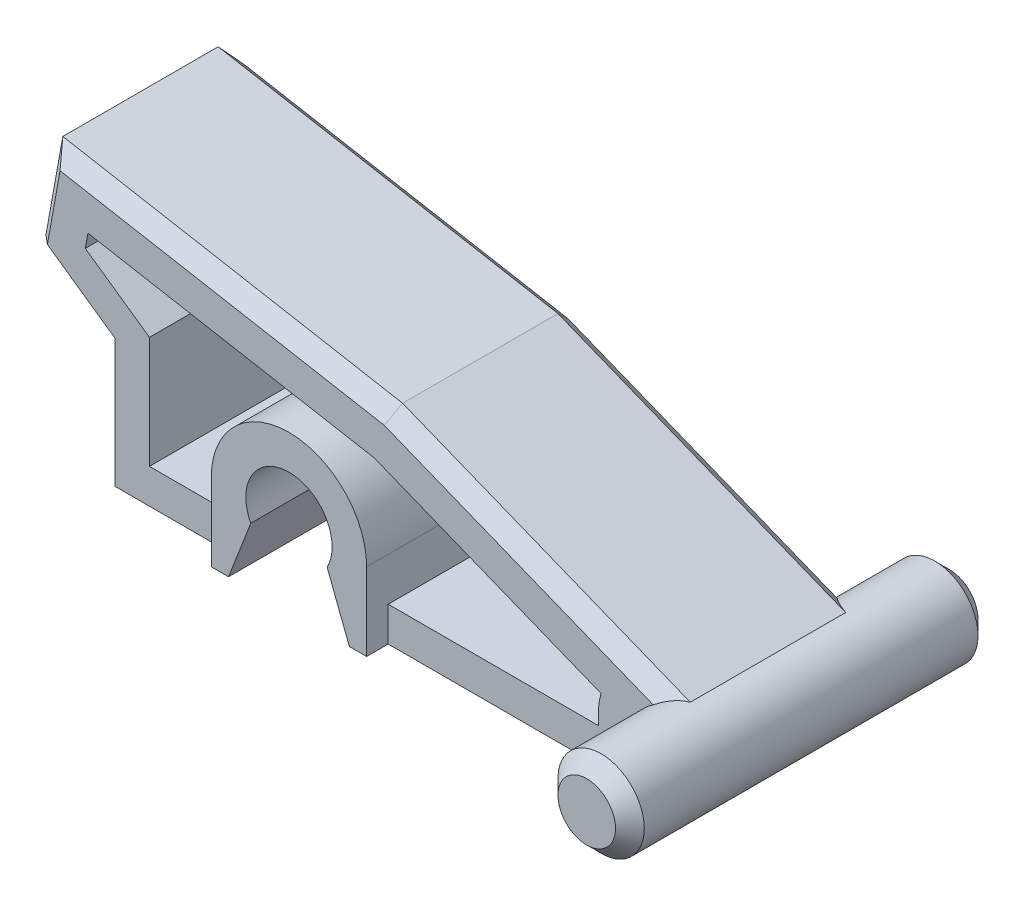
from build123d import *

# Parameters (mm, degrees)
BOSS_EXTRUDE1_DEPTH     = 3.2
BOSS_EXTRUDE2_DEPTH     = 0.75
CUT_EXTRUDE1_DEPTH      = 16.439388307
CUT_EXTRUDE1_DEPTH_BACK = 16.439388307
SKETCH4_R               = 1.5
BOSS_EXTRUDE3_DEPTH     = 6.3
CHAMFER1_SIZE           = 0.5
CHAMFER2_SIZE           = 0.5
CUT_EXTRUDE2_DEPTH      = 5.2


with BuildPart() as part:
    # Sketch1 → Boss-Extrude1 (new, symmetric)
    with BuildSketch(Plane.XY):
        Polygon((-10, -4.4), (10, -4.4), (10, -1.4), (0, 2.6), (-10, 4.4), (-10, -0.2), align=None)
        Polygon((-12.394804782, 1.478031011), (-10, -0.2), (-10, 4.4), (-11.810199888, 4.72583598), align=None)
    extrude(amount=BOSS_EXTRUDE1_DEPTH, both=True)

    # Sketch2 → Boss-Extrude2 (add, symmetric)
    with BuildSketch(Plane.XY.offset(3.2)):
        with BuildLine():
            ThreePointArc((0, -1.7), (-2.7, 1), (-5.4, -1.7))
            Line((-5.4, -1.7), (-2.7, -4.4))
            Line((-2.7, -4.4), (0, -1.7))
        make_face()
        with BuildLine():
            Line((-2.7, -4.4), (-5.4, -1.7))
            ThreePointArc((-5.4, -1.7), (-4.609188309, -3.609188309), (-2.7, -4.4))
        make_face()
        with BuildLine():
            Line((0, -1.7), (-2.7, -4.4))
            ThreePointArc((-2.7, -4.4), (-0.790811691, -3.609188309), (0, -1.7))
        make_face()
        with BuildLine():
            ThreePointArc((0, -1.7), (-0.790811691, -3.609188309), (-2.7, -4.4))
            Line((-2.7, -4.4), (0, -4.4))
            Line((0, -4.4), (0, -1.7))
        make_face()
        with BuildLine():
            ThreePointArc((-2.7, -4.4), (-4.609188309, -3.609188309), (-5.4, -1.7))
            Line((-5.4, -1.7), (-5.4, -4.4))
            Line((-5.4, -4.4), (-2.7, -4.4))
        make_face()
    boss_extrude2 = extrude(amount=BOSS_EXTRUDE2_DEPTH, both=True)

    # Mirror1: Boss-Extrude2 across plane
    add(boss_extrude2.mirror(Plane.XY))

    # Sketch3 → Cut-Extrude1 (cut, two sides: drawn at the far end of the back side and taken through both)
    with BuildSketch(Plane.XY.offset(3.95).offset(-CUT_EXTRUDE1_DEPTH_BACK)):
        with BuildLine():
            ThreePointArc((-1.2, -1.7), (-3.060572549, -0.243982336), (-4.026649916, -2.4))
            Line((-4.026649916, -2.4), (-1.373350084, -2.4))
            ThreePointArc((-1.373350084, -2.4), (-1.243982336, -2.060572549), (-1.2, -1.7))
        make_face()
        with BuildLine():
            Line((-1.373350084, -2.4), (-4.026649916, -2.4))
            ThreePointArc((-4.026649916, -2.4), (-2.7, -3.2), (-1.373350084, -2.4))
        make_face()
        with BuildLine():
            Line((-4.026649916, -2.4), (-4.8, -4.4))
            Line((-4.8, -4.4), (-0.6, -4.4))
            Line((-0.6, -4.4), (-1.373350084, -2.4))
            ThreePointArc((-1.373350084, -2.4), (-2.7, -3.2), (-4.026649916, -2.4))
        make_face()
    extrude(amount=CUT_EXTRUDE1_DEPTH + CUT_EXTRUDE1_DEPTH_BACK, mode=Mode.SUBTRACT)

    # Sketch4 → Boss-Extrude3 (add, symmetric)
    with BuildSketch(Plane.XY):
        with Locations((10, -2.9)):
            Circle(SKETCH4_R)
    extrude(amount=BOSS_EXTRUDE3_DEPTH, both=True)

    # Chamfer1
    chamfer1_edges = [part.edges().sort_by_distance(p)[0] for p in [
        (8.5, -2.9, -6.3),
        (8.5, -2.9, 6.3),
    ]]
    chamfer(chamfer1_edges, length=CHAMFER1_SIZE)

    # Chamfer2
    chamfer2_edges = [part.edges().sort_by_distance(p)[0] for p in [
        (-5.905099944, 3.66291799, 3.2),
        (-11.197402391, 0.639015505, -3.2),
        (-12.102502335, 3.101933495, -3.2),
        (-5.905099944, 3.66291799, -3.2),
        (5, 0.6, -3.2),
        (-12.102502335, 3.101933495, 3.2),
        (-11.197402391, 0.639015505, 3.2),
        (-10, -2.3, 3.2),
        (5, 0.6, 3.2),
        (-10, -2.3, -3.2),
    ]]
    chamfer(chamfer2_edges, length=CHAMFER2_SIZE)

    # Sketch5 → Cut-Extrude2 (cut)
    with BuildSketch(Plane.XY.offset(3.2)):
        with BuildLine():
            Line((-10.438248334, 2.751564232), (-10.529148071, 2.246565691))
            Line((-10.529148071, 2.246565691), (-8.3, 0.684609736))
            Line((-8.3, 0.684609736), (-8.3, -3.2))
            Line((-8.3, -3.2), (-5.4, -3.2))
            Line((-5.4, -3.2), (-5.4, -1.7))
            ThreePointArc((-5.4, -1.7), (-2.7, 1), (0, -1.7))
            Line((0, -1.7), (0, -3.2))
            Line((0, -3.2), (7.316718427, -3.2))
            ThreePointArc((7.316718427, -3.2), (7.308115775, -2.690812714), (7.395278362, -2.189067379))
            Line((7.395278362, -2.189067379), (-0.471070755, 0.957472268))
            Line((-0.471070755, 0.957472268), (-10.438248334, 2.751564232))
        make_face()
    extrude(amount=-CUT_EXTRUDE2_DEPTH, mode=Mode.SUBTRACT)


solid = part.part
